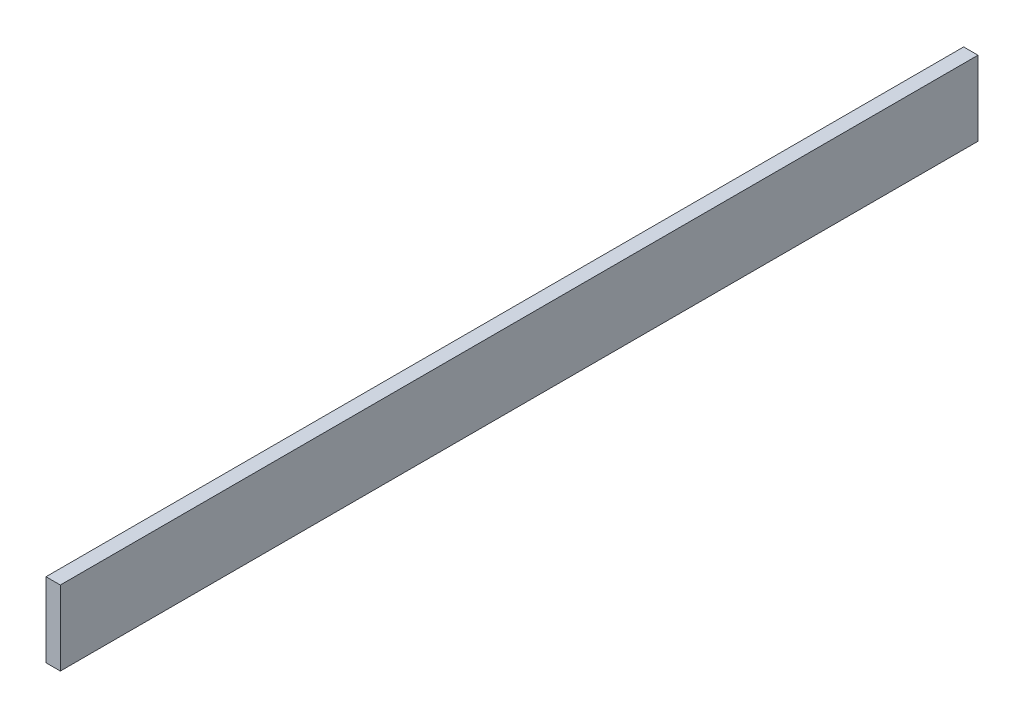
from build123d import *

# Parameters (mm, degrees)
SKETCH1_W           = 406.4
SKETCH1_H           = 33.02
BOSS_EXTRUDE1_DEPTH = 6.35


with BuildPart() as part:
    # Sketch1 → Boss-Extrude1 (new body)
    with BuildSketch(Plane(origin=(0, 0, 0), x_dir=(0, 0, -1), z_dir=(1, 0, 0))):
        with Locations((203.2, 16.51)):
            Rectangle(SKETCH1_W, SKETCH1_H)
    extrude(amount=BOSS_EXTRUDE1_DEPTH)


solid = part.part
